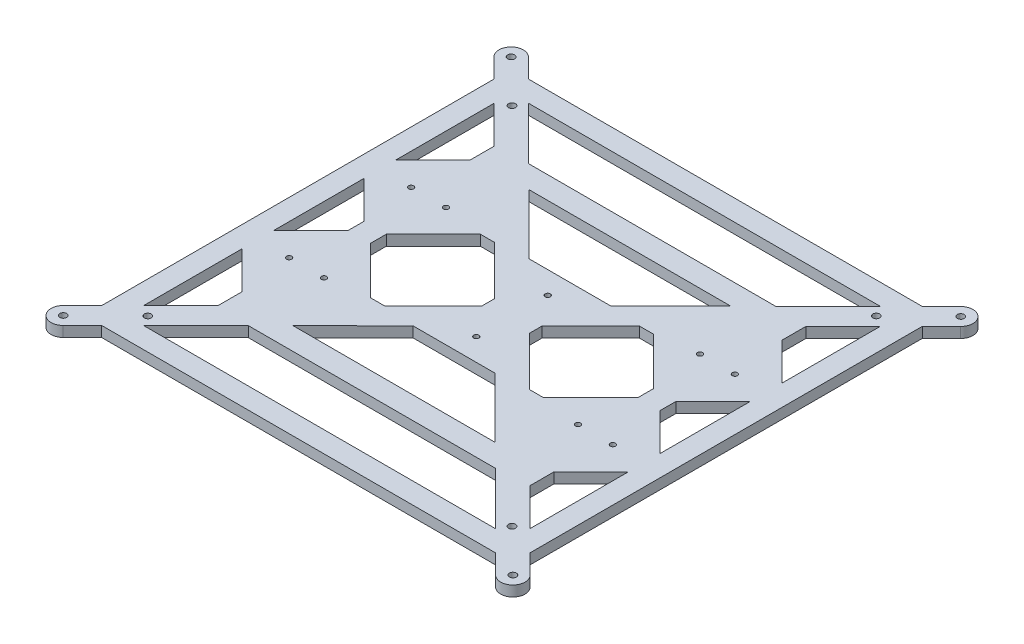
from build123d import *

# Parameters (mm, degrees)
ESBO_O1_R                = 2
ESBO_O1_R_2              = 1.5
RESSALTO_EXTRUS_O1_DEPTH = 6
RESSALTO_EXTRUS_O2_START = -6
ESBO_O2_R                = 2
RESSALTO_EXTRUS_O2_DEPTH = 6
RESSALTO_EXTRUS_O4_DEPTH = 6


with BuildPart() as part:
    # Esboço1 → Ressalto-extrusão1 (new body)
    with BuildSketch(Plane(origin=(0, 0, 0), x_dir=(1, 0, 0), z_dir=(0, 1, 0))):
        with BuildLine():
            Line((99.9745166, -4.5254834), (71.398066402, 24.050966799))
            Line((71.398066402, 24.050966799), (-71.398066402, 24.050966799))
            Line((-71.398066402, 24.050966799), (-99.9745166, -4.5254834))
            ThreePointArc((-99.9745166, -4.5254834), (-109.0254834, -4.5254834), (-109.0254834, 4.5254834))
            Line((-109.0254834, 4.5254834), (-89.5, 24.050966799))
            Line((-89.5, 24.050966799), (-89.5, 39.050966799))
            Line((-89.5, 39.050966799), (-102.5, 52.050966799))
            Line((-102.5, 52.050966799), (-102.5, 86.949033201))
            Line((-102.5, 86.949033201), (-89.5, 99.949033201))
            Line((-89.5, 99.949033201), (-89.5, 109.050966799))
            Line((-89.5, 109.050966799), (-102.5, 122.050966799))
            Line((-102.5, 122.050966799), (-102.5, 156.949033201))
            Line((-102.5, 156.949033201), (-89.5, 169.949033201))
            Line((-89.5, 169.949033201), (-89.5, 184.949033201))
            Line((-89.5, 184.949033201), (-109.0254834, 204.4745166))
            ThreePointArc((-109.0254834, 204.4745166), (-109.0254834, 213.5254834), (-99.9745166, 213.5254834))
            Line((-99.9745166, 213.5254834), (-71.398066402, 184.949033201))
            Line((-71.398066402, 184.949033201), (71.398066402, 184.949033201))
            Line((71.398066402, 184.949033201), (99.9745166, 213.5254834))
            ThreePointArc((99.9745166, 213.5254834), (109.0254834, 213.5254834), (109.0254834, 204.4745166))
            Line((109.0254834, 204.4745166), (89.5, 184.949033201))
            Line((89.5, 184.949033201), (89.5, 169.949033201))
            Line((89.5, 169.949033201), (102.5, 156.949033201))
            Line((102.5, 156.949033201), (102.5, 122.050966799))
            Line((102.5, 122.050966799), (89.5, 109.050966799))
            Line((89.5, 109.050966799), (89.5, 99.949033201))
            Line((89.5, 99.949033201), (102.5, 86.949033201))
            Line((102.5, 86.949033201), (102.5, 52.050966799))
            Line((102.5, 52.050966799), (89.5, 39.050966799))
            Line((89.5, 39.050966799), (89.5, 24.050966799))
            Line((89.5, 24.050966799), (109.0254834, 4.5254834))
            ThreePointArc((109.0254834, 4.5254834), (109.0254834, -4.5254834), (99.9745166, -4.5254834))
        make_face()
        with Locations(Location((104.5, 209, 0), (0, 0, 270))):
            Circle(ESBO_O1_R, mode=Mode.SUBTRACT)
        with Locations(Location((104.5, 0, 0), (0, 0, 270))):
            Circle(ESBO_O1_R, mode=Mode.SUBTRACT)
        with Locations(Location((0, 125, 0), (0, 0, 270))):
            Circle(ESBO_O1_R_2, mode=Mode.SUBTRACT)
        with Locations(Location((0, 84, 0), (0, 0, 270))):
            Circle(ESBO_O1_R_2, mode=Mode.SUBTRACT)
        with Locations(Location((72.9, 139.5, 0), (0, 0, 270))):
            Circle(ESBO_O1_R_2, mode=Mode.SUBTRACT)
        with Locations(Location((92.9, 139.5, 0), (0, 0, 270))):
            Circle(ESBO_O1_R_2, mode=Mode.SUBTRACT)
        with Locations(Location((72.9, 69.5, 0), (0, 0, 270))):
            Circle(ESBO_O1_R_2, mode=Mode.SUBTRACT)
        with Locations(Location((92.9, 69.5, 0), (0, 0, 270))):
            Circle(ESBO_O1_R_2, mode=Mode.SUBTRACT)
        with Locations(Location((-92.9, 69.5, 0), (0, 0, 270))):
            Circle(ESBO_O1_R_2, mode=Mode.SUBTRACT)
        with Locations(Location((-72.9, 69.5, 0), (0, 0, 270))):
            Circle(ESBO_O1_R_2, mode=Mode.SUBTRACT)
        with Locations(Location((-92.9, 139.5, 0), (0, 0, 270))):
            Circle(ESBO_O1_R_2, mode=Mode.SUBTRACT)
        with Locations(Location((-72.9, 139.5, 0), (0, 0, 270))):
            Circle(ESBO_O1_R_2, mode=Mode.SUBTRACT)
        with Locations(Location((-104.5, 0, 0), (0, 0, 270))):
            Circle(ESBO_O1_R, mode=Mode.SUBTRACT)
        with Locations(Location((-104.5, 209, 0), (0, 0, 270))):
            Circle(ESBO_O1_R, mode=Mode.SUBTRACT)
        Polygon((-58.598066402, 172.149033201), (58.598066402, 172.149033201), (24.249033201, 137.8), (-24.249033201, 137.8), align=None, mode=Mode.SUBTRACT)
        Polygon((40.600966799, 136.05), (13.601933598, 109.050966799), (13.601933598, 99.949033201), (40.600966799, 72.95), (49.700966799, 72.95), (76.7, 99.949033201), (76.7, 109.050966799), (49.700966799, 136.05), align=None, mode=Mode.SUBTRACT)
        Polygon((-58.598066402, 36.850966799), (58.598066402, 36.850966799), (24.249033201, 71.2), (-24.249033201, 71.2), align=None, mode=Mode.SUBTRACT)
        Polygon((-40.600966799, 72.95), (-13.601933598, 99.949033201), (-13.601933598, 109.050966799), (-40.600966799, 136.05), (-49.700966799, 136.05), (-76.7, 109.050966799), (-76.7, 99.949033201), (-49.700966799, 72.95), align=None, mode=Mode.SUBTRACT)
    extrude(amount=RESSALTO_EXTRUS_O1_DEPTH)

    # Esboço2 → Ressalto-extrusão2 (add)
    with BuildSketch(Plane(origin=(0, 6, 0), x_dir=(1, 0, 0), z_dir=(0, 1, 0)).offset(RESSALTO_EXTRUS_O2_START)):
        with BuildLine():
            Line((-133.940126995, 228.040650721), (-9.918773353, 104.5))
            Line((-9.918773353, 104.5), (-133.940126995, -19.040650721))
            ThreePointArc((-133.940126995, -19.040650721), (-133.959349279, -28.940126995), (-124.059873005, -28.959349279))
            Line((-124.059873005, -28.959349279), (0, 94.619671505))
            Line((0, 94.619671505), (124.059873005, -28.959349279))
            ThreePointArc((124.059873005, -28.959349279), (133.959349279, -28.940126995), (133.940126995, -19.040650721))
            Line((133.940126995, -19.040650721), (9.918773353, 104.5))
            Line((9.918773353, 104.5), (133.940126995, 228.040650721))
            ThreePointArc((133.940126995, 228.040650721), (133.959349279, 237.940126995), (124.059873005, 237.959349279))
            Line((124.059873005, 237.959349279), (0, 114.380328495))
            Line((0, 114.380328495), (-124.059873005, 237.959349279))
            ThreePointArc((-124.059873005, 237.959349279), (-133.959349279, 237.940126995), (-133.940126995, 228.040650721))
        make_face()
        with Locations(Location((-129, 233, 0), (0, 0, 270))):
            Circle(ESBO_O2_R, mode=Mode.SUBTRACT)
        with Locations(Location((129, 233, 0), (0, 0, 270))):
            Circle(ESBO_O2_R, mode=Mode.SUBTRACT)
        with Locations(Location((129, -24, 0), (0, 0, 270))):
            Circle(ESBO_O2_R, mode=Mode.SUBTRACT)
        with Locations(Location((-129, -24, 0), (0, 0, 270))):
            Circle(ESBO_O2_R, mode=Mode.SUBTRACT)
        with Locations(Location((104.5, 0, 0), (0, 0, 270))):
            Circle(ESBO_O2_R, mode=Mode.SUBTRACT)
        with Locations(Location((-104.5, 0, 0), (0, 0, 270))):
            Circle(ESBO_O2_R, mode=Mode.SUBTRACT)
        with Locations(Location((104.5, 209, 0), (0, 0, 270))):
            Circle(ESBO_O2_R, mode=Mode.SUBTRACT)
        with Locations(Location((-104.5, 209, 0), (0, 0, 270))):
            Circle(ESBO_O2_R, mode=Mode.SUBTRACT)
    extrude(amount=RESSALTO_EXTRUS_O2_DEPTH)

    # Esboço4 → Ressalto-extrusão4 (add)
    with BuildSketch(Plane(origin=(0, 6, 0), x_dir=(1, 0, 0), z_dir=(0, 1, 0))):
        Polygon((102.5, 86.949033201), (110.840276613, 78.608756588), (110.840276613, 130.391243412), (102.5, 122.050966799), (102.5, 156.949033201), (110.840276613, 148.608756588), (110.840276613, 205.030334643), (122.88696922, 217.030334643), (122.88696922, -8.030334643), (110.840276613, 3.969665357), (110.840276613, 60.391243412), (102.5, 52.050966799), align=None)
        Polygon((-113.00671523, 226.949033201), (113.00671523, 226.949033201), (100.960022623, 214.949033201), (-100.960022623, 214.949033201), align=None)
        Polygon((-110.840276613, 130.391243412), (-110.840276613, 78.608756588), (-102.5, 86.949033201), (-102.5, 52.050966799), (-110.840276613, 60.391243412), (-110.840276613, 3.969665357), (-122.88696922, -8.030334643), (-122.88696922, 217.030334643), (-110.840276613, 205.030334643), (-110.840276613, 148.608756588), (-102.5, 156.949033201), (-102.5, 122.050966799), align=None)
        Polygon((-100.960022623, -5.949033201), (100.960022623, -5.949033201), (113.00671523, -17.949033201), (-113.00671523, -17.949033201), align=None)
    extrude(amount=-RESSALTO_EXTRUS_O4_DEPTH)


solid = part.part
